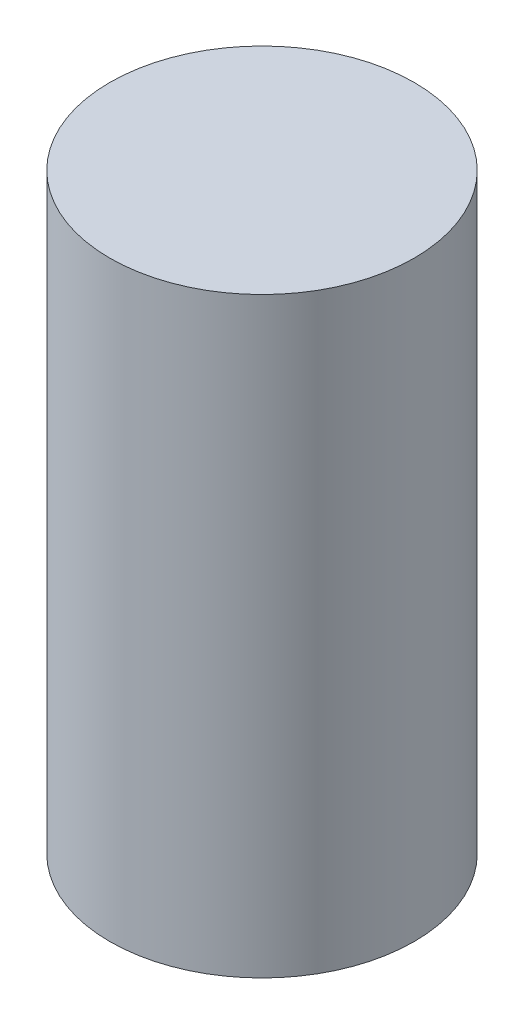
from build123d import *

# Parameters (mm, degrees)
SKETCH1_R           = 36
BOSS_EXTRUDE1_DEPTH = 140


with BuildPart() as part:
    # Sketch1 → Boss-Extrude1 (new body)
    with BuildSketch(Plane(origin=(0, 0, 0), x_dir=(1, 0, 0), z_dir=(0, 1, 0))):
        with Locations(Location((0, 0, 0), (0, 0, 270))):
            Circle(SKETCH1_R)
    extrude(amount=BOSS_EXTRUDE1_DEPTH)


solid = part.part
